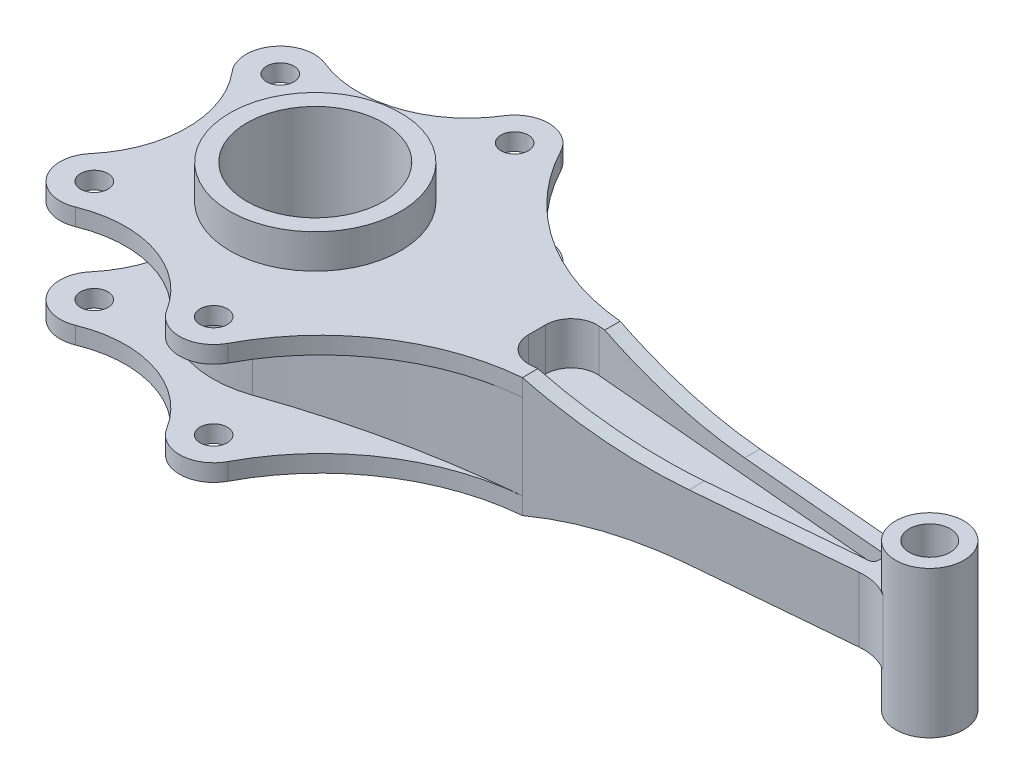
from build123d import *

# Parameters (mm, degrees)
SKETCH1_R           = 25
SKETCH1_R_2         = 10
SKETCH1_R_3         = 4
SKETCH1_R_4         = 20
BOSS_EXTRUDE1_DEPTH = 17.5
SKETCH1_4_R         = 25
SKETCH1_4_R_2       = 20
BOSS_EXTRUDE2_DEPTH = 27.5
SKETCH2_R           = 20
CUT_EXTRUDE1_DEPTH  = 12.5
CUT_EXTRUDE2_DEPTH  = 183.275863787
SKETCH1_5_R         = 10
SKETCH1_5_R_2       = 6
BOSS_EXTRUDE3_DEPTH = 21.5
FILLET3_R           = 15
CUT_EXTRUDE3_DEPTH  = 12.5
FILLET1_R           = 7.5
FILLET2_R           = 1.5


with BuildPart() as part:
    # Sketch1 → Boss-Extrude1 (new, symmetric)
    # profile 1 of 6: a face of its own
    with BuildSketch(Plane(origin=(0, 0, 0), x_dir=(1, 0, 0), z_dir=(0, 1, 0))):
        with BuildLine():
            ThreePointArc((23.169245136, -48.74831039), (44.696355929, -24.926018406), (75, -14.314362055))
            Line((75, -14.314362055), (171.881275704, -5.838348723))
            ThreePointArc((171.881275704, -5.838348723), (170, 0), (171.881275704, 5.838348723))
            Line((171.881275704, 5.838348723), (75, 14.314362055))
            ThreePointArc((75, 14.314362055), (44.696355929, 24.926018406), (23.169245136, 48.74831039))
            ThreePointArc((23.169245136, 48.74831039), (24.030815541, 46.486476164), (24.323725422, 44.083893922))
            ThreePointArc((24.323725422, 44.083893922), (11.593351964, 34.463859578), (5.814713266, 49.337151209))
            ThreePointArc((5.814713266, 49.337151209), (-11.588137289, 35.664619361), (-33.70385172, 36.496791078))
            ThreePointArc((-33.70385172, 36.496791078), (-29.194535449, 32.814838368), (-27.5, 27.2453448))
            ThreePointArc((-27.5, 27.2453448), (-34.054404214, 17.857700278), (-45.125573936, 20.776139119))
            ThreePointArc((-45.125573936, 20.776139119), (-37.5, 0), (-45.125573936, -20.776139119))
            ThreePointArc((-45.125573936, -20.776139119), (-34.054404214, -17.857700278), (-27.5, -27.2453448))
            ThreePointArc((-27.5, -27.2453448), (-29.194535449, -32.814838368), (-33.70385172, -36.496791078))
            ThreePointArc((-33.70385172, -36.496791078), (-11.588137289, -35.664619361), (5.814713266, -49.337151209))
            ThreePointArc((5.814713266, -49.337151209), (11.593351964, -34.463859578), (24.323725422, -44.083893922))
            ThreePointArc((24.323725422, -44.083893922), (24.030815541, -46.486476164), (23.169245136, -48.74831039))
        make_face()
        Circle(SKETCH1_R, mode=Mode.SUBTRACT)
    # profile 2 of 6: a face of its own
    with BuildSketch(Plane(origin=(0, 0, 0), x_dir=(1, 0, 0), z_dir=(0, 1, 0))):
        with Locations((14.323725422, 44.083893922)):
            Circle(SKETCH1_R_2)
        with Locations(Location((14.323725422, 44.083893922, 0), (0, 0, 270))):
            Circle(SKETCH1_R_3, mode=Mode.SUBTRACT)
    # profile 3 of 6: a face of its own
    with BuildSketch(Plane(origin=(0, 0, 0), x_dir=(1, 0, 0), z_dir=(0, 1, 0))):
        with Locations((-37.5, 27.2453448)):
            Circle(SKETCH1_R_2)
        with Locations(Location((-37.5, 27.2453448, 0), (0, 0, 270))):
            Circle(SKETCH1_R_3, mode=Mode.SUBTRACT)
    # profile 4 of 6: a face of its own
    with BuildSketch(Plane(origin=(0, 0, 0), x_dir=(1, 0, 0), z_dir=(0, 1, 0))):
        with Locations((-37.5, -27.2453448)):
            Circle(SKETCH1_R_2)
        with Locations(Location((-37.5, -27.2453448, 0), (0, 0, 270))):
            Circle(SKETCH1_R_3, mode=Mode.SUBTRACT)
    # profile 5 of 6: a face of its own
    with BuildSketch(Plane(origin=(0, 0, 0), x_dir=(1, 0, 0), z_dir=(0, 1, 0))):
        with Locations((14.323725422, -44.083893922)):
            Circle(SKETCH1_R_2)
        with Locations(Location((14.323725422, -44.083893922, 0), (0, 0, 270))):
            Circle(SKETCH1_R_3, mode=Mode.SUBTRACT)
    # profile 6 of 6: a face of its own
    with BuildSketch(Plane(origin=(0, 0, 0), x_dir=(1, 0, 0), z_dir=(0, 1, 0))):
        Circle(SKETCH1_R)
        with Locations(Location((0, 0, 0), (0, 0, 270))):
            Circle(SKETCH1_R_4, mode=Mode.SUBTRACT)
    extrude(amount=BOSS_EXTRUDE1_DEPTH, both=True)

    # Sketch1<4> → Boss-Extrude2 (add, symmetric)
    with BuildSketch(Plane(origin=(0, 0, 0), x_dir=(1, 0, 0), z_dir=(0, 1, 0))):
        with Locations(Location((0, 0, 0), (0, 0, 270))):
            Circle(SKETCH1_4_R)
        with Locations(Location((0, 0, 0), (0, 0, 270))):
            Circle(SKETCH1_4_R_2, mode=Mode.SUBTRACT)
    extrude(amount=BOSS_EXTRUDE2_DEPTH, both=True)

    # Sketch2 → Cut-Extrude1 (cut, symmetric)
    with BuildSketch(Plane(origin=(0, 0, 0), x_dir=(1, 0, 0), z_dir=(0, 1, 0))):
        with Locations(Location((0, 0, 0), (0, 0, 270))):
            Circle(SKETCH2_R)
        with BuildLine():
            ThreePointArc((9.905954739, 28.31734558), (-30, 0), (9.905954739, -28.31734558))
            ThreePointArc((9.905954739, -28.31734558), (42.01613595, -19.285159783), (75, -14.314362055))
            ThreePointArc((75, -14.314362055), (44.696355929, -24.926018406), (23.169245136, -48.74831039))
            ThreePointArc((23.169245136, -48.74831039), (14.662831175, -54.078142632), (5.814713266, -49.337151209))
            ThreePointArc((5.814713266, -49.337151209), (-11.588137289, -35.664619361), (-33.70385172, -36.496791078))
            ThreePointArc((-33.70385172, -36.496791078), (-45.590169944, -33.123197323), (-45.125573936, -20.776139119))
            ThreePointArc((-45.125573936, -20.776139119), (-37.5, 0), (-45.125573936, 20.776139119))
            ThreePointArc((-45.125573936, 20.776139119), (-45.590169944, 33.123197323), (-33.70385172, 36.496791078))
            ThreePointArc((-33.70385172, 36.496791078), (-11.588137289, 35.664619361), (5.814713266, 49.337151209))
            ThreePointArc((5.814713266, 49.337151209), (14.662831175, 54.078142632), (23.169245136, 48.74831039))
            ThreePointArc((23.169245136, 48.74831039), (44.696355929, 24.926018406), (75, 14.314362055))
            ThreePointArc((75, 14.314362055), (42.01613595, 19.285159783), (9.905954739, 28.31734558))
        make_face()
    extrude(amount=CUT_EXTRUDE1_DEPTH, both=True, mode=Mode.SUBTRACT)

    # Sketch3 → Cut-Extrude2 (cut, symmetric)
    with BuildSketch(Plane.XY):
        with BuildLine():
            Line((171.881275704, 17.5), (171.881275704, 9.5))
            Line((171.881275704, 9.5), (119.899888641, 9.5))
            ThreePointArc((119.899888641, 9.5), (97.096380139, 11.515625954), (75, 17.5))
            Line((75, 17.5), (119.899888641, 17.5))
            Line((119.899888641, 17.5), (171.881275704, 17.5))
        make_face()
    cut_extrude2 = extrude(amount=CUT_EXTRUDE2_DEPTH, both=True, mode=Mode.SUBTRACT)

    # Mirror1: Cut-Extrude2 across plane
    add(cut_extrude2.mirror(Plane.ZX), mode=Mode.SUBTRACT)

    # Sketch1<5> → Boss-Extrude3 (add, symmetric)
    with BuildSketch(Plane(origin=(0, 0, 0), x_dir=(1, 0, 0), z_dir=(0, 1, 0))):
        with Locations(Location((180, 0, 0), (0, 0, 270))):
            Circle(SKETCH1_5_R)
        with Locations(Location((180, 0, 0), (0, 0, 270))):
            Circle(SKETCH1_5_R_2, mode=Mode.SUBTRACT)
    extrude(amount=BOSS_EXTRUDE3_DEPTH, both=True)

    # Fillet3
    fillet3_edges = [part.edges().sort_by_distance(p)[0] for p in [
        (171.881275704, 0, -5.838348723),
        (171.881275704, 0, 5.838348723),
    ]]
    fillet(fillet3_edges, radius=FILLET3_R)

    # Sketch4 → Cut-Extrude3 (cut)
    with BuildSketch(Plane(origin=(0, 17.5, 0), x_dir=(1, 0, 0), z_dir=(0, 1, 0))):
        with BuildLine():
            Line((65, 10.672059421), (65, -10.672059421))
            Line((65, -10.672059421), (119.507687799, -5.903254663))
            Line((119.507687799, -5.903254663), (165.620941154, -1.868867757))
            ThreePointArc((165.620941154, -1.868867757), (165.5, 0), (165.620941154, 1.868867757))
            Line((165.620941154, 1.868867757), (119.507687799, 5.903254663))
            Line((119.507687799, 5.903254663), (65, 10.672059421))
        make_face()
    cut_extrude3 = extrude(amount=-CUT_EXTRUDE3_DEPTH, mode=Mode.SUBTRACT)

    # Mirror2: Cut-Extrude3 across plane
    add(cut_extrude3.mirror(Plane.ZX), mode=Mode.SUBTRACT)

    # Fillet1
    fillet1_edges = [part.edges().sort_by_distance(p)[0] for p in [
        (65, 11.25, -10.672059421),
        (65, 11.25, 10.672059421),
        (65, -11.25, -10.672059421),
        (65, -11.25, 10.672059421),
    ]]
    fillet(fillet1_edges, radius=FILLET1_R)

    # Fillet2
    fillet2_edges = [part.edges().sort_by_distance(p)[0] for p in [
        (165.620941154, 7.25, -1.868867757),
        (165.620941154, 7.25, 1.868867757),
        (165.620941154, -7.25, 1.868867757),
        (165.620941154, -7.25, -1.868867757),
    ]]
    fillet(fillet2_edges, radius=FILLET2_R)


solid = part.part
